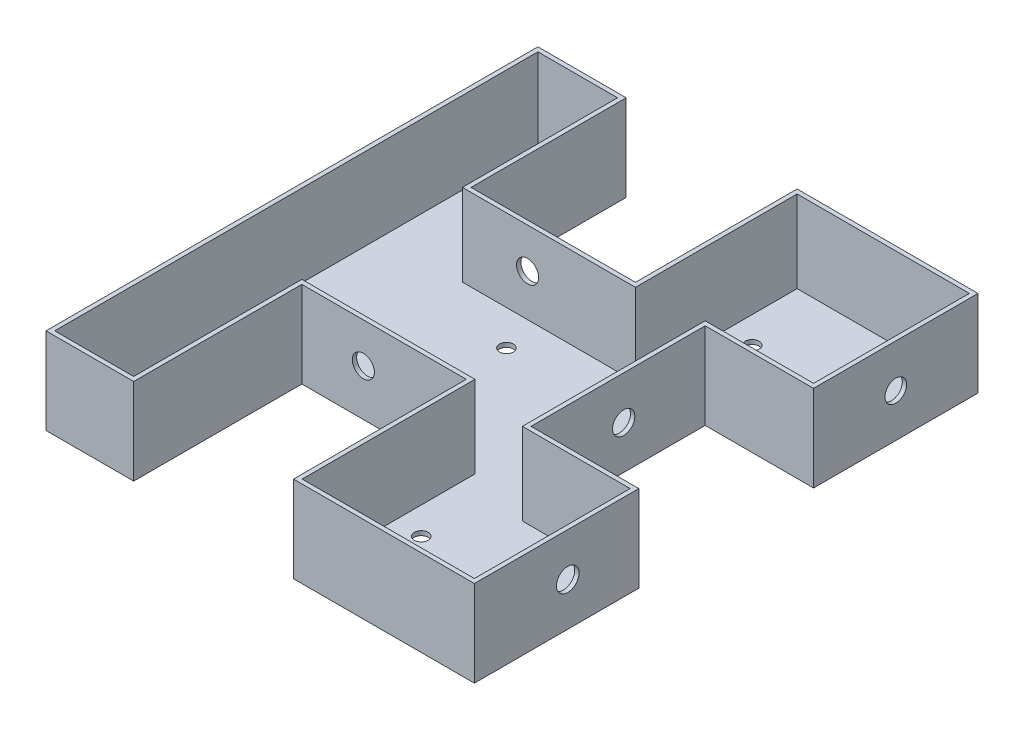
from build123d import *

# Parameters (mm, degrees)
BOSS_EXTRUDE2_DEPTH = 20
SHELL1_T            = -1
SKETCH5_R           = 2.554490716
CUT_EXTRUDE1_DEPTH  = 40.64
SKETCH6_R           = 2.564818337
SKETCH6_R_2         = 2.573203383
SKETCH6_R_3         = 2.511002724
CUT_EXTRUDE3_DEPTH  = 10
SKETCH7_R           = 2.582908473
CUT_EXTRUDE4_DEPTH  = 10
SKETCH9_R           = 2.619720314
CUT_EXTRUDE6_DEPTH  = 10
SKETCH10_R          = 1.6
CUT_EXTRUDE7_DEPTH  = 10


with BuildPart() as part:
    # Sketch1 → Boss-Extrude2 (new body)
    with BuildSketch(Plane(origin=(0, 0, 0), x_dir=(1, 0, 0), z_dir=(0, 1, 0))):
        Polygon((543.066064215, -1022.739016237), (543.066064215, -1018.517703014), (584.976064215, -1018.517703014), (584.976064215, -1056.617703014), (559.865211068, -1056.617703014), (559.865211068, -1096.973737777), (584.842442734, -1096.973737777), (584.842442734, -1103.207715654), (584.842442734, -1135.073737777), (542.932442734, -1135.073737777), (542.932442734, -1128.271846788), (542.932442734, -1095.03316), (504.832442734, -1095.03316), (504.832442734, -1128.271846788), (504.832442734, -1133.999106761), (484.512442734, -1133.999106761), (484.512442734, -1020.023649765), (504.966064215, -1020.023649765), (504.966064215, -1022.739016237), (504.966064215, -1055.977703024), (543.066064215, -1055.977703024), align=None)
    extrude(amount=BOSS_EXTRUDE2_DEPTH)

    # Shell1
    shell1_openings = [part.faces().sort_by_distance(p)[0] for p in [
        (534.165694699, 20, 1076.58641914),
    ]]
    offset(amount=SHELL1_T, openings=shell1_openings, kind=Kind.INTERSECTION)

    # Sketch5 → Cut-Extrude1 (cut)
    with BuildSketch(Plane.XY.offset(1095.03316)):
        with Locations((519.077633691, 10.743789128)):
            Circle(SKETCH5_R)
    extrude(amount=-CUT_EXTRUDE1_DEPTH, mode=Mode.SUBTRACT)

    # Sketch6 → Cut-Extrude3 (cut)
    with BuildSketch(Plane(origin=(584.976064215, 0, 0), x_dir=(0, 0, -1), z_dir=(1, 0, 0))):
        with Locations(Location((-1113.44316001, 10, 0), (0, 0, 180))):
            Circle(SKETCH6_R)
        with Locations((-1075.505431512, 10)):
            Circle(SKETCH6_R_2)
        with Locations((-1037.567703014, 10)):
            Circle(SKETCH6_R_3)
    extrude(amount=-CUT_EXTRUDE3_DEPTH, mode=Mode.SUBTRACT)

    # Sketch7 → Cut-Extrude4 (cut)
    with BuildSketch(Plane(origin=(559.865211068, 0, 0), x_dir=(0, 0, -1), z_dir=(1, 0, 0))):
        with Locations((-1075.505431512, 10)):
            Circle(SKETCH7_R)
    extrude(amount=-CUT_EXTRUDE4_DEPTH, mode=Mode.SUBTRACT)

    # Sketch9 → Cut-Extrude6 (cut)
    with BuildSketch(Plane(origin=(584.842442734, 0, 0), x_dir=(0, 0, -1), z_dir=(1, 0, 0))):
        with Locations((-1113.44316001, 10)):
            Circle(SKETCH9_R)
    extrude(amount=-CUT_EXTRUDE6_DEPTH, mode=Mode.SUBTRACT)

    # Sketch10 → Cut-Extrude7 (cut)
    with BuildSketch(Plane(origin=(0, 1, 0), x_dir=(1, 0, 0), z_dir=(0, 1, 0))):
        with Locations(Location((494.947633691, -1112.763160005, 0), (0, 0, 270))):
            Circle(SKETCH10_R)
        with Locations(Location((550.205220573, -1112.763160005, 0), (0, 0, 270))):
            Circle(SKETCH10_R)
        with Locations(Location((522.30969217, -1084.732316133, 0), (0, 0, 270))):
            Circle(SKETCH10_R)
        with Locations(Location((522.30969217, -1065.102492134, 0), (0, 0, 270))):
            Circle(SKETCH10_R)
        with Locations(Location((550.205220573, -1036.067482908, 0), (0, 0, 270))):
            Circle(SKETCH10_R)
        with Locations(Location((494.023662931, -1036.067482908, 0), (0, 0, 270))):
            Circle(SKETCH10_R)
    extrude(amount=-CUT_EXTRUDE7_DEPTH, mode=Mode.SUBTRACT)


solid = part.part
